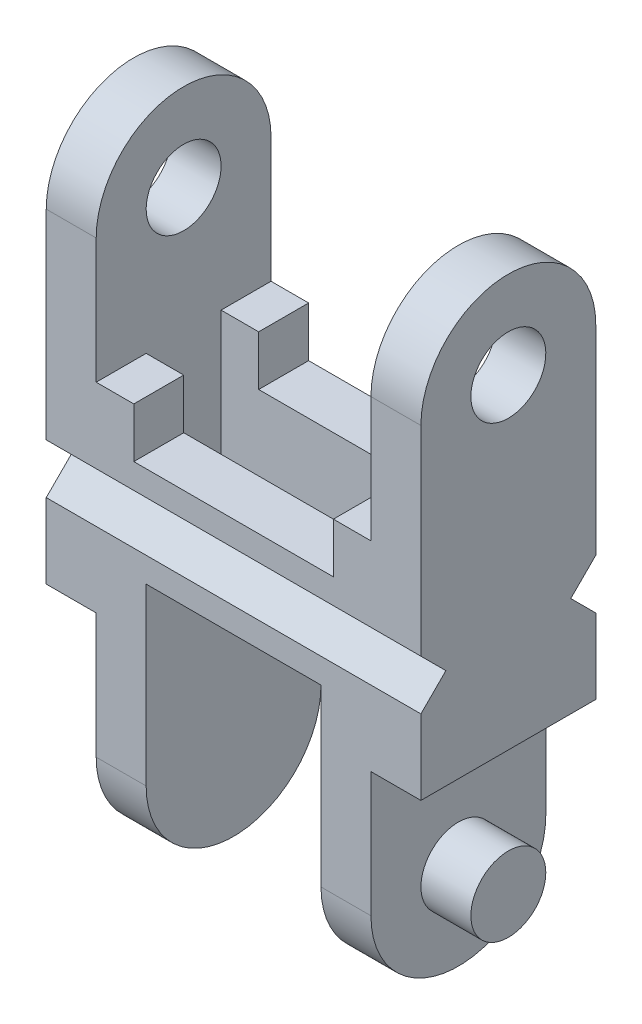
from build123d import *

# Parameters (mm, degrees)
SKETCH_1_W          = 15
SKETCH_1_H          = 25
EXTRUDE_1_DEPTH     = 2
SKETCH_2_W          = 2
SKETCH_2_H          = 25
EXTRUDE_2_DEPTH     = 5
SKETCH_4_W          = 13
SKETCH_4_H          = 4
SKETCH_4_W_2        = 2
EXTRUDE_3_DEPTH     = 2
SKETCH_5_W          = 11
SKETCH_5_H          = 8.5
CUT_EXTRUDE_1_DEPTH = 2
SKETCH_6_W          = 7.990156946
SKETCH_6_H          = 2
CUT_EXTRUDE_2_DEPTH = 17.170961629
CUT_EXTRUDE_3_DEPTH = 21.742468513
FILLET_1_RADIUS     = 3.5
FILLET_1_LENGTH     = 2
FILLET_2_RADIUS     = 3.5
FILLET_2_LENGTH     = 2
SKETCH_9_R          = 1.5
CUT_EXTRUDE_4_DEPTH = 21.742468513
SKETCH_13_W         = 2
SKETCH_13_H         = 8.5
CUT_EXTRUDE_7_DEPTH = 7
SKETCH_14_W         = 1.504921527
SKETCH_14_H         = 2
EXTRUDE_8_DEPTH     = 7
FILLET_3_RADIUS     = 3.5
FILLET_3_LENGTH     = 2
FILLET_4_RADIUS     = 3.5
FILLET_4_LENGTH     = 2
SKETCH_15_R         = 1.5
EXTRUDE_9_DEPTH     = 2
EXTRUDE_START       = 2
SKETCH_16_R         = 1.5
EXTRUDE_10_DEPTH    = 2


with BuildPart() as part:
    # Эскиз1 → Бобышка-Вытянуть1 (new body)
    with BuildSketch(Plane.XY):
        Rectangle(SKETCH_1_W, SKETCH_1_H)
    extrude(amount=EXTRUDE_1_DEPTH)

    # Эскиз2 → Бобышка-Вытянуть2 (add)
    with BuildSketch(Plane.XY.offset(2)):
        with Locations((-6.5, 0)):
            Rectangle(SKETCH_2_W, SKETCH_2_H)
        with Locations((6.5, 0)):
            Rectangle(SKETCH_2_W, SKETCH_2_H)
    extrude(amount=EXTRUDE_2_DEPTH)

    # Эскиз4 → Бобышка-Вытянуть3 (add)
    with BuildSketch(Plane.XY.offset(7)):
        with Locations((-1, 2)):
            Rectangle(SKETCH_4_W, SKETCH_4_H)
        with Locations((-1, -2)):
            Rectangle(SKETCH_4_W, SKETCH_4_H)
        with Locations((6.5, -2)):
            Rectangle(SKETCH_4_W_2, SKETCH_4_H)
        with Locations((6.5, 2)):
            Rectangle(SKETCH_4_W_2, SKETCH_4_H)
    extrude(amount=-EXTRUDE_3_DEPTH)

    # Эскиз5 → Вырез-Вытянуть1 (cut)
    with BuildSketch(Plane(origin=(0, 0, 0), x_dir=(-1, 0, 0), z_dir=(0, 0, -1))):
        with Locations((0, 8.25)):
            Rectangle(SKETCH_5_W, SKETCH_5_H)
        with Locations((0, -8.25)):
            Rectangle(SKETCH_5_W, SKETCH_5_H)
    extrude(amount=-CUT_EXTRUDE_1_DEPTH, mode=Mode.SUBTRACT)

    # Эскиз6 → Вырез-Вытянуть2 (cut, through all)
    with BuildSketch(Plane.XY.offset(7)):
        with Locations((0, 3)):
            Rectangle(SKETCH_6_W, SKETCH_6_H)
        with Locations((0, -3)):
            Rectangle(SKETCH_6_W, SKETCH_6_H)
    extrude(amount=-CUT_EXTRUDE_2_DEPTH, mode=Mode.SUBTRACT)

    # Эскиз8 → Вырез-Вытянуть3 (cut, through all)
    with BuildSketch(Plane.ZY.offset(7.5)):
        Polygon((7, -1), (7, 0), (6, 0), align=None)
        Polygon((6, 0), (7, 0), (7, 1), align=None)
        Polygon((0, -1), (1, 0), (0, 0), align=None)
        Polygon((0, 0), (1, 0), (0, 1), align=None)
    extrude(amount=-CUT_EXTRUDE_3_DEPTH, mode=Mode.SUBTRACT)

    # Скругление1: full round fillet: the end face becomes a half cylinder, R = half its width
    fillet_1_face = Plane((-6.5, 12.5, 3.5), x_dir=(1, 0, 0), z_dir=(0, 1, 0))  # on the end face: x along it, z out of the body
    fillet_1_slab = fillet_1_face.offset(-FILLET_1_RADIUS / 2) * Box(FILLET_1_LENGTH, 2 * FILLET_1_RADIUS, FILLET_1_RADIUS, mode=Mode.PRIVATE)  # the body's end, R deep
    fillet_1_round = Plane((-6.5, 9, 3.5), x_dir=(0, 1, 0), z_dir=(1, 0, 0)) * Cylinder(FILLET_1_RADIUS, FILLET_1_LENGTH, mode=Mode.PRIVATE)  # its axis R under the face
    add(fillet_1_slab - fillet_1_round, mode=Mode.SUBTRACT)

    # Скругление2: full round fillet: the end face becomes a half cylinder, R = half its width
    fillet_2_face = Plane((6.5, 12.5, 3.5), x_dir=(1, 0, 0), z_dir=(0, 1, 0))  # on the end face: x along it, z out of the body
    fillet_2_slab = fillet_2_face.offset(-FILLET_2_RADIUS / 2) * Box(FILLET_2_LENGTH, 2 * FILLET_2_RADIUS, FILLET_2_RADIUS, mode=Mode.PRIVATE)  # the body's end, R deep
    fillet_2_round = Plane((6.5, 9, 3.5), x_dir=(0, 1, 0), z_dir=(1, 0, 0)) * Cylinder(FILLET_2_RADIUS, FILLET_2_LENGTH, mode=Mode.PRIVATE)  # its axis R under the face
    add(fillet_2_slab - fillet_2_round, mode=Mode.SUBTRACT)

    # Эскиз9 → Вырез-Вытянуть4 (cut, through all)
    with BuildSketch(Plane.ZY.offset(7.5)):
        with Locations(Location((3.5, 9, 0), (0, 0, 270))):
            Circle(SKETCH_9_R)
    extrude(amount=-CUT_EXTRUDE_4_DEPTH, mode=Mode.SUBTRACT)

    # Эскиз13 → Вырез-Вытянуть7 (cut)
    with BuildSketch(Plane.XY.offset(7)):
        with Locations((6.5, -8.25)):
            Rectangle(SKETCH_13_W, SKETCH_13_H)
        with Locations((-6.5, -8.25)):
            Rectangle(SKETCH_13_W, SKETCH_13_H)
    extrude(amount=-CUT_EXTRUDE_7_DEPTH, mode=Mode.SUBTRACT)

    # Эскиз14 → Бобышка-Вытянуть8 (add)
    with BuildSketch(Plane.XY.offset(7)):
        Polygon((5.5, -12.5), (5.5, -4), (3.995078473, -4), (3.995078473, -2), (3.5, -2), (3.5, -12.5), align=None)
        with Locations((4.747539236, -3)):
            Rectangle(SKETCH_14_W, SKETCH_14_H)
        Polygon((-3.5, -12.5), (-3.5, -2), (-3.995078473, -2), (-3.995078473, -4), (-5.5, -4), (-5.5, -12.5), align=None)
        with Locations((-4.747539236, -3)):
            Rectangle(SKETCH_14_W, SKETCH_14_H)
    extrude(amount=-EXTRUDE_8_DEPTH)

    # Скругление3: full round fillet: the end face becomes a half cylinder, R = half its width
    fillet_3_face = Plane((-4.5, -12.5, 3.5), x_dir=(1, 0, 0), z_dir=(0, -1, 0))  # on the end face: x along it, z out of the body
    fillet_3_slab = fillet_3_face.offset(-FILLET_3_RADIUS / 2) * Box(FILLET_3_LENGTH, 2 * FILLET_3_RADIUS, FILLET_3_RADIUS, mode=Mode.PRIVATE)  # the body's end, R deep
    fillet_3_round = Plane((-4.5, -9, 3.5), x_dir=(0, -1, 0), z_dir=(1, 0, 0)) * Cylinder(FILLET_3_RADIUS, FILLET_3_LENGTH, mode=Mode.PRIVATE)  # its axis R under the face
    add(fillet_3_slab - fillet_3_round, mode=Mode.SUBTRACT)

    # Скругление4: full round fillet: the end face becomes a half cylinder, R = half its width
    fillet_4_face = Plane((4.5, -12.5, 3.5), x_dir=(-1, 0, 0), z_dir=(0, -1, 0))  # on the end face: x along it, z out of the body
    fillet_4_slab = fillet_4_face.offset(-FILLET_4_RADIUS / 2) * Box(FILLET_4_LENGTH, 2 * FILLET_4_RADIUS, FILLET_4_RADIUS, mode=Mode.PRIVATE)  # the body's end, R deep
    fillet_4_round = Plane((4.5, -9, 3.5), x_dir=(0, -1, 0), z_dir=(-1, 0, 0)) * Cylinder(FILLET_4_RADIUS, FILLET_4_LENGTH, mode=Mode.PRIVATE)  # its axis R under the face
    add(fillet_4_slab - fillet_4_round, mode=Mode.SUBTRACT)

    # Эскиз15 → Бобышка-Вытянуть9 (add)
    with BuildSketch(Plane(origin=(5.5, 0, 0), x_dir=(0, 0, -1), z_dir=(1, 0, 0))):
        with Locations((-3.5, -9)):
            Circle(SKETCH_15_R)
    extrude(amount=EXTRUDE_9_DEPTH)

    # Эскиз16 → Бобышка-Вытянуть10 (add)
    with BuildSketch(Plane.ZY.offset(5.5).offset(EXTRUDE_START)):
        with Locations(Location((3.5, -9, 0), (0, 0, 180))):
            Circle(SKETCH_16_R)
    extrude(amount=-EXTRUDE_10_DEPTH)


solid = part.part
